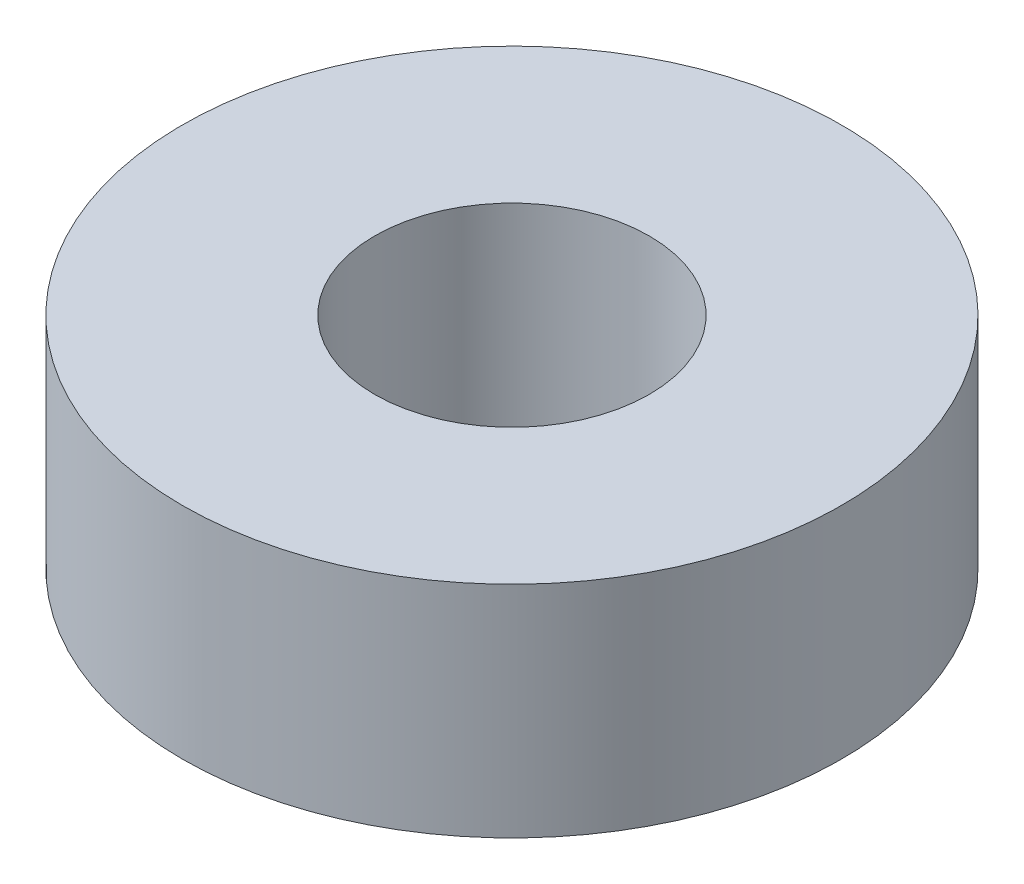
from build123d import *

# Parameters (mm, degrees)
SKETCH1_R           = 6
SKETCH1_R_2         = 2.5
BOSS_EXTRUDE1_DEPTH = 4


with BuildPart() as part:
    # Sketch1 → Boss-Extrude1 (new body)
    with BuildSketch(Plane(origin=(0, 0, 0), x_dir=(1, 0, 0), z_dir=(0, 1, 0))):
        with Locations(Location((0, 0, 0), (0, 0, 270))):
            Circle(SKETCH1_R)
        with Locations(Location((0, 0, 0), (0, 0, 270))):
            Circle(SKETCH1_R_2, mode=Mode.SUBTRACT)
    extrude(amount=BOSS_EXTRUDE1_DEPTH)


solid = part.part
